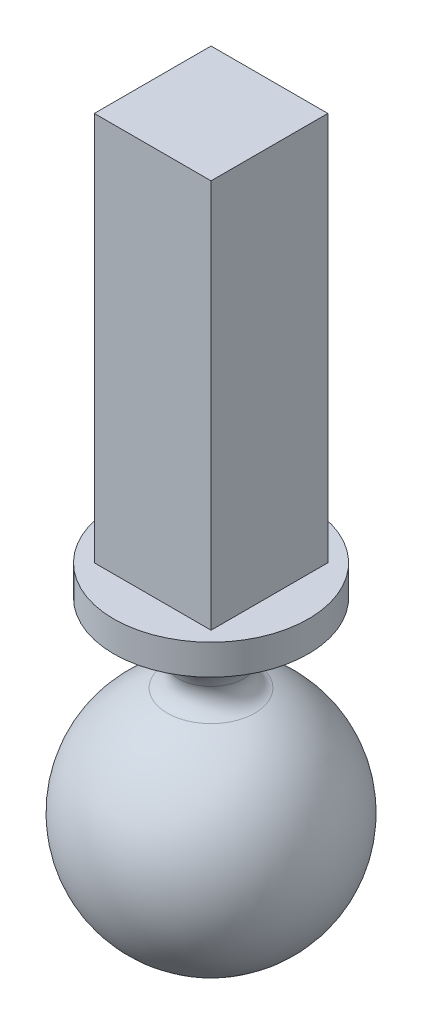
from build123d import *

# Parameters (mm, degrees)
SKETCH_2_W      = 6
SKETCH_2_H      = 6
EXTRUDE_1_DEPTH = 20


with BuildPart() as part:
    # 草图1 → 旋转1 (revolve)
    with BuildSketch(Plane.XY, mode=Mode.PRIVATE) as revolve_1_sk:
        with BuildLine():
            Line((-5, 9.572809864), (-5, 11.128838899))
            Line((-5, 11.128838899), (-3.694047059, 11.128838899))
            Line((-3.694047059, 11.128838899), (0, 11.128838899))
            Line((0, 11.128838899), (0, -6))
            ThreePointArc((0, -6), (-5.889524943, -1.146078506), (-2.249952649, 5.56216802))
            ThreePointArc((-2.249952649, 5.56216802), (-1.71510176, 6.07424335), (-1.67910561, 6.813831678))
            add(Edge.make_bspline(
                [(-1.67910561, 6.813831678), (-2.255406993, 8.492909128), (-5, 9.572809864)],
                knots=[0, 0, 0, 1, 1, 1], degree=2))
        make_face()
    revolve(revolve_1_sk.sketch.rotate(Axis((0, 11.882352941, 0), (0, -1, 0)), 270), axis=Axis((0, 11.882352941, 0), (0, -1, 0)))

    # 草图2 → 凸台-拉伸1 (add)
    with BuildSketch(Plane(origin=(0, 11.128838899, 0), x_dir=(1, 0, 0), z_dir=(0, 1, 0))):
        Rectangle(SKETCH_2_W, SKETCH_2_H)
    extrude(amount=EXTRUDE_1_DEPTH)


solid = part.part
